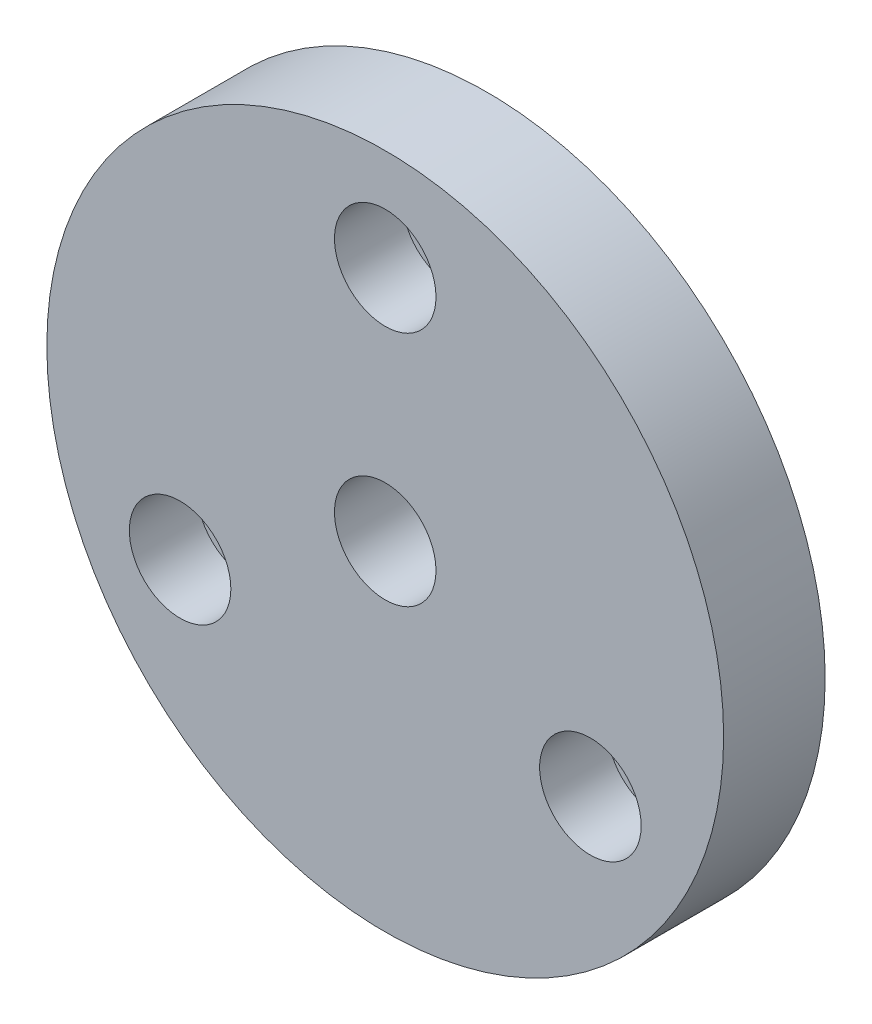
from build123d import *

# Parameters (mm, degrees)
ESQUISSE1_R             = 20
ESQUISSE1_R_2           = 3
EXTRUSION1_DEPTH        = 6
ESQUISSE2_R             = 3
ENL_V_MAT_EXTRU_1_DEPTH = 4


with BuildPart() as part:
    # Esquisse1 → Extrusion1 (new body)
    with BuildSketch(Plane.XY):
        Circle(ESQUISSE1_R)
        Circle(ESQUISSE1_R_2, mode=Mode.SUBTRACT)
    extrude(amount=EXTRUSION1_DEPTH)

    # Esquisse2 → Enlèv. mat.-Extru.1 (cut)
    with BuildSketch(Plane.XY.offset(6)):
        with Locations((0, 14)):
            Circle(ESQUISSE2_R)
        with Locations((12.124355653, -7)):
            Circle(ESQUISSE2_R)
        with Locations((-12.124355653, -7)):
            Circle(ESQUISSE2_R)
    extrude(amount=-ENL_V_MAT_EXTRU_1_DEPTH, mode=Mode.SUBTRACT)


solid = part.part
